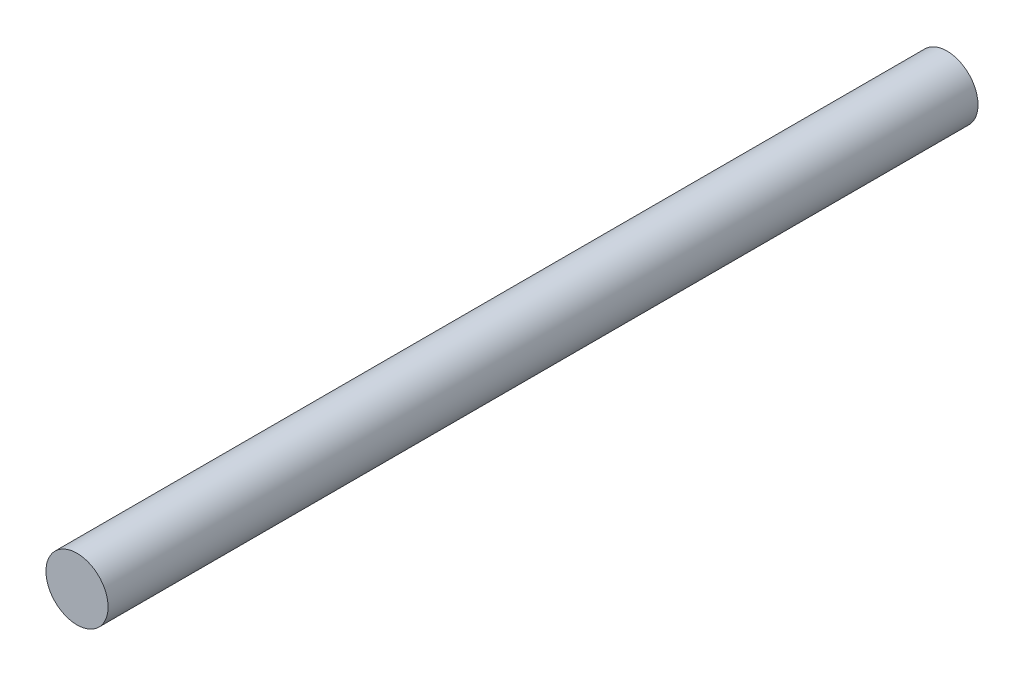
from build123d import *

# Parameters (mm, degrees)
CROQUIS1_R              = 5
SALIENTE_EXTRUIR1_DEPTH = 70


with BuildPart() as part:
    # Croquis1 → Saliente-Extruir1 (new, symmetric)
    with BuildSketch(Plane.XY):
        Circle(CROQUIS1_R)
    extrude(amount=SALIENTE_EXTRUIR1_DEPTH, both=True)


solid = part.part
